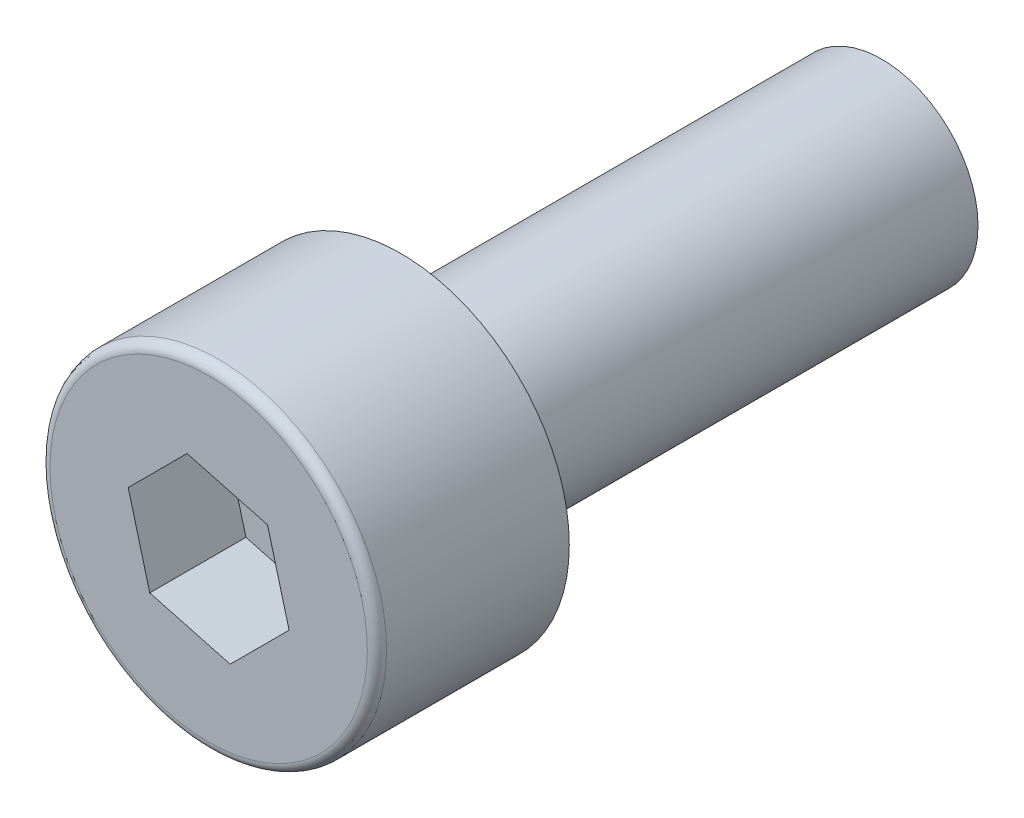
from build123d import *

# Parameters (mm, degrees)
SKETCH_1_R          = 3.5
EXTRUDE_1_DEPTH     = 4
CUT_EXTRUDE_1_DEPTH = 2
SKETCH_3_R          = 2
EXTRUDE_2_DEPTH     = 10
FILLET_1_R          = 0.2


with BuildPart() as part:
    # 草图1 → 凸台-拉伸1 (new body)
    with BuildSketch(Plane.XY):
        Circle(SKETCH_1_R)
    extrude(amount=EXTRUDE_1_DEPTH)

    # 草图2 → 切除-拉伸1 (cut)
    with BuildSketch(Plane.XY.offset(4)):
        Polygon((-1.224744871, -1.224744871), (0.448287736, -1.673032607), (1.673032607, -0.448287736), (1.224744871, 1.224744871), (-0.448287736, 1.673032607), (-1.673032607, 0.448287736), align=None)
    extrude(amount=-CUT_EXTRUDE_1_DEPTH, mode=Mode.SUBTRACT)

    # 草图3 → 凸台-拉伸2 (add)
    with BuildSketch(Plane(origin=(0, 0, 0), x_dir=(-1, 0, 0), z_dir=(0, 0, -1))):
        with Locations(Location((0, 0, 0), (0, 0, 180))):
            Circle(SKETCH_3_R)
    extrude(amount=EXTRUDE_2_DEPTH)

    # 圆角1
    fillet_1_edges = [part.edges().sort_by_distance(p)[0] for p in [
        (-3.5, 0, 4),
    ]]
    fillet(fillet_1_edges, radius=FILLET_1_R)


solid = part.part
